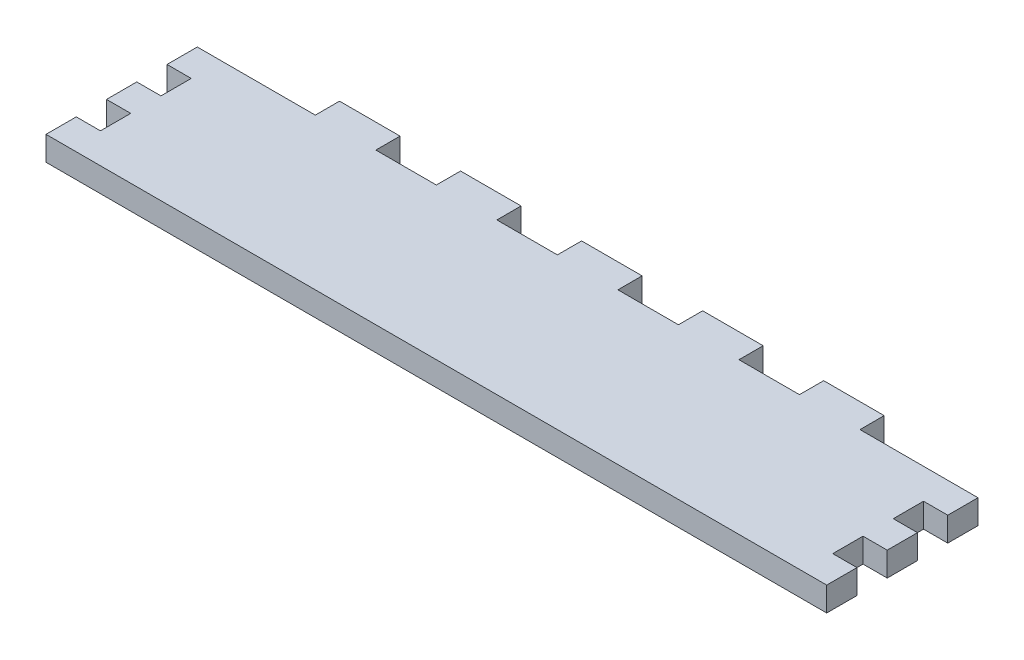
from build123d import *

# Parameters (mm, degrees)
SKETCH1_W           = 121
SKETCH1_H           = 25
BOSS_EXTRUDE1_DEPTH = 4
SKETCH3_W           = 10
SKETCH3_H           = 4
BOSS_EXTRUDE3_DEPTH = 4
LPATTERN2_COUNT     = 3
LPATTERN2_PITCH     = 20
LPATTERN2_COL_COUNT = 3
LPATTERN2_COL_PITCH = 20
SKETCH4_W           = 4
SKETCH4_H           = 5
BOSS_EXTRUDE4_DEPTH = 4
LPATTERN3_COUNT     = 3
LPATTERN3_PITCH     = 10


with BuildPart() as part:
    # Sketch1 → Boss-Extrude1 (new body)
    with BuildSketch(Plane(origin=(0, 0, 0), x_dir=(1, 0, 0), z_dir=(0, 1, 0))):
        with Locations((60.5, -12.5)):
            Rectangle(SKETCH1_W, SKETCH1_H)
    extrude(amount=BOSS_EXTRUDE1_DEPTH)

    # Sketch3 → Boss-Extrude3 (add, through all)
    with BuildSketch(Plane(origin=(0, 0, 0), x_dir=(-1, 0, 0), z_dir=(0, -1, 0))):
        with Locations((-60.5, 2)):
            Rectangle(SKETCH3_W, SKETCH3_H)
    boss_extrude3 = extrude(amount=-BOSS_EXTRUDE3_DEPTH)

    # LPattern2: Boss-Extrude3 ×3
    with Locations(*[(i * LPATTERN2_PITCH, 0, 0) for i in range(1, LPATTERN2_COUNT)]):
        add(boss_extrude3)

    # LPattern2 col: Boss-Extrude3 ×3
    with Locations(*[(-i * LPATTERN2_COL_PITCH, 0, 0) for i in range(1, LPATTERN2_COL_COUNT)]):
        add(boss_extrude3)

    # Sketch4 → Boss-Extrude4 (add, through all)
    with BuildSketch(Plane(origin=(0, 4, 0), x_dir=(1, 0, 0), z_dir=(0, 1, 0))):
        with Locations((-2, -22.5)):
            Rectangle(SKETCH4_W, SKETCH4_H)
        with Locations((123, -22.5)):
            Rectangle(SKETCH4_W, SKETCH4_H)
    boss_extrude4 = extrude(amount=-BOSS_EXTRUDE4_DEPTH)

    # LPattern3: Boss-Extrude4 ×3
    with Locations(*[(0, 0, -i * LPATTERN3_PITCH) for i in range(1, LPATTERN3_COUNT)]):
        add(boss_extrude4)


solid = part.part
